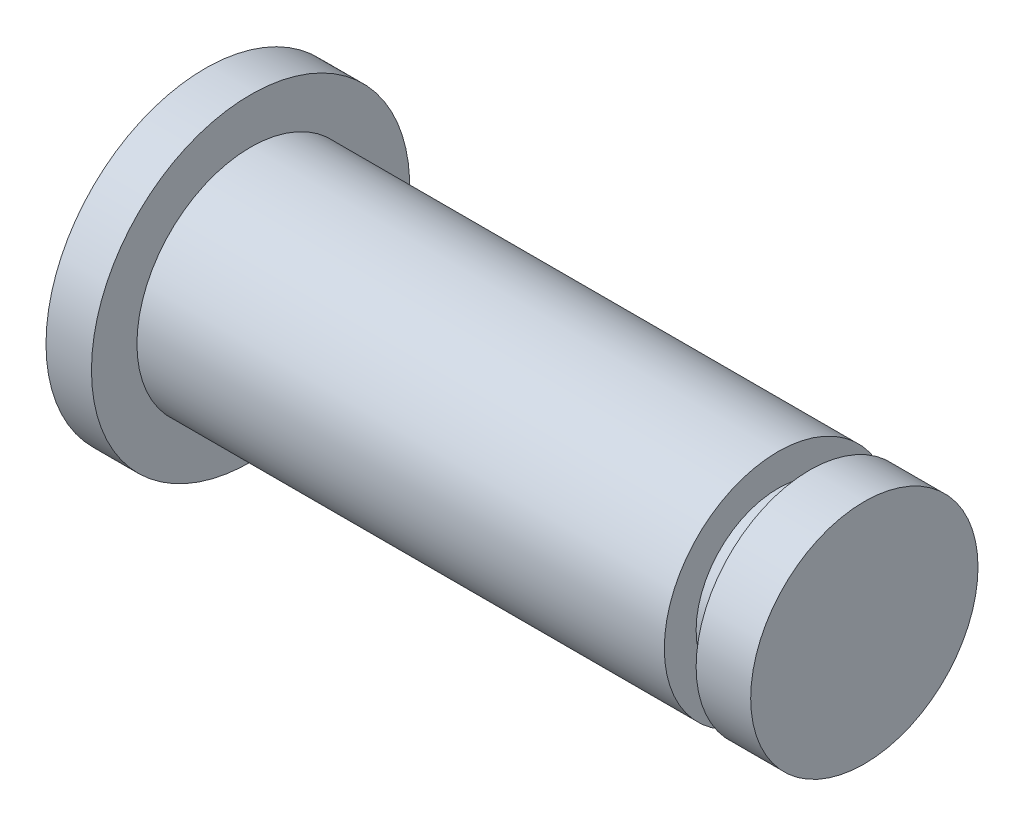
from build123d import *


with BuildPart() as part:
    # 草图1 → 旋转1 (revolve)
    with BuildSketch(Plane.XY, mode=Mode.PRIVATE) as revolve_1_sk:
        Polygon((0, 0), (145, 0), (145, 25), (133, 25), (133, 18), (126, 18), (126, 25), (10, 25), (10, 35), (0, 35), align=None)
    revolve(revolve_1_sk.sketch.rotate(Axis((0, 0, 0), (1, 0, 0)), 90), axis=Axis((0, 0, 0), (1, 0, 0)))


solid = part.part
